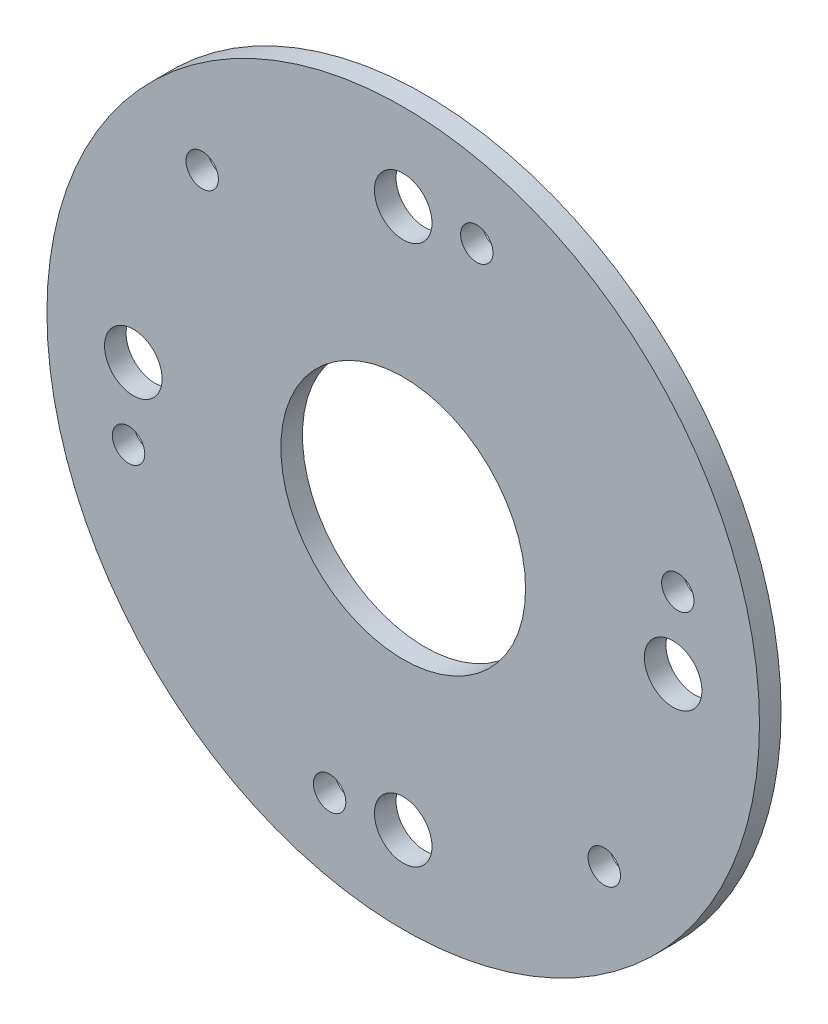
from build123d import *

# Parameters (mm, degrees)
CARRIER_FRONT_START = 55.5
SKETCH_1_R          = 49.5
SKETCH_1_R_2        = 17
CARRIER_FRONT_DEPTH = 3
SKETCH_2_R          = 2.25
THROUGH_HOLES_DEPTH = 100
SKETCH_3_R          = 4
CUT_EXTRUDE_2_DEPTH = 100


with BuildPart() as part:
    # Эскиз1 → Carrier_front (new body)
    with BuildSketch(Plane.XY.offset(CARRIER_FRONT_START)):
        Circle(SKETCH_1_R)
        Circle(SKETCH_1_R_2, mode=Mode.SUBTRACT)
    extrude(amount=CARRIER_FRONT_DEPTH)

    # Эскиз2 → Through_holes (cut, symmetric)
    with BuildSketch(Plane.XY):
        with Locations((37.5, 0)):
            Circle(SKETCH_2_R)
        with Locations((0, 37.5)):
            Circle(SKETCH_2_R)
        with Locations((-37.5, 0)):
            Circle(SKETCH_2_R)
        with Locations((0, -37.5)):
            Circle(SKETCH_2_R)
        with Locations((38.154070138, 10.223352282)):
            Circle(SKETCH_2_R)
        with Locations((10.223352282, 38.154070138)):
            Circle(SKETCH_2_R)
        with Locations((-27.930717857, 27.930717857)):
            Circle(SKETCH_2_R)
        with Locations((-38.154070138, -10.223352282)):
            Circle(SKETCH_2_R)
        with Locations((-10.223352282, -38.154070138)):
            Circle(SKETCH_2_R)
        with Locations((27.930717857, -27.930717857)):
            Circle(SKETCH_2_R)
    extrude(amount=THROUGH_HOLES_DEPTH, both=True, mode=Mode.SUBTRACT)

    # Эскиз3 → Вырез-Вытянуть2 (cut, symmetric)
    with BuildSketch(Plane.XY):
        with Locations((37.5, 0)):
            Circle(SKETCH_3_R)
        with Locations((0, 37.5)):
            Circle(SKETCH_3_R)
        with Locations((-37.5, 0)):
            Circle(SKETCH_3_R)
        with Locations((0, -37.5)):
            Circle(SKETCH_3_R)
    extrude(amount=CUT_EXTRUDE_2_DEPTH, both=True, mode=Mode.SUBTRACT)


solid = part.part
